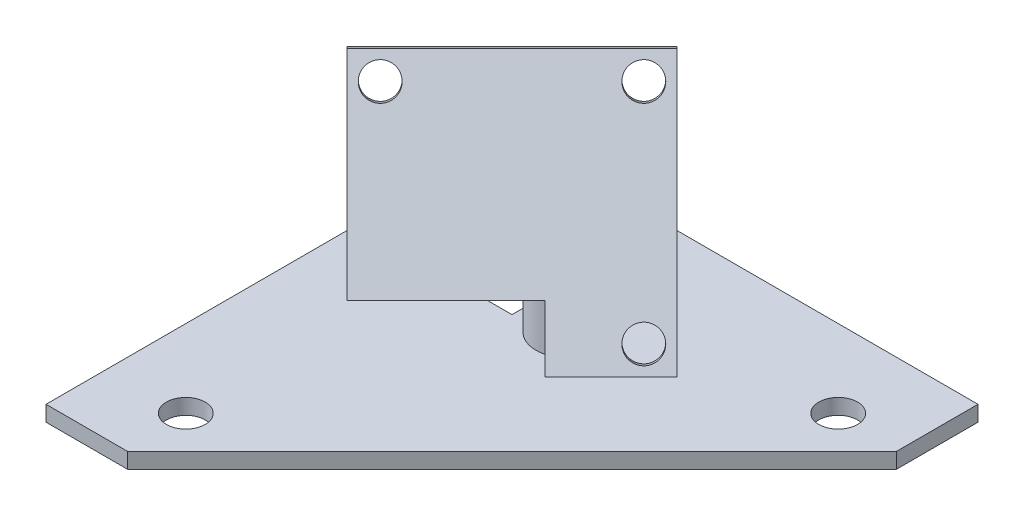
from build123d import *

# Parameters (mm, degrees)
SKETCH_1_R      = 2.5
EXTRUDE_1_DEPTH = 2
SKETCH_2_R      = 2
EXTRUDE_3_DEPTH = 2
EXTRUDE_4_REACH = 91.774
SKETCH_4_R      = 4


with BuildPart() as part:
    # 草图1 → 凸台-拉伸1 (new body)
    with BuildSketch(Plane(origin=(0, 0, 0), x_dir=(1, 0, 0), z_dir=(0, 1, 0))):
        Polygon((10.502525317, -60), (60, -10.502525317), (60, 0), (20, 0), (20, -20), (0, -20), (0, -60), align=None)
        with Locations(Location((10, -52, 0), (0, 0, 270))):
            Circle(SKETCH_1_R, mode=Mode.SUBTRACT)
        with Locations(Location((52, -10, 0), (0, 0, 270))):
            Circle(SKETCH_1_R, mode=Mode.SUBTRACT)
    extrude(amount=EXTRUDE_1_DEPTH)



with BuildPart() as body_2:
    # 草图2 → 凸台-拉伸3 (new body)
    with BuildSketch(Plane(origin=(23.112372436, 18.871173071, 23.112372436), x_dir=(-0.7071067811865475, 0, 0.7071067811865477), z_dir=(0.6123724356957955, 0.4999999999999981, 0.6123724356957954))):
        Polygon((-3, 16.786030205), (-15, 16.786030205), (-15, -13.213969795), (15, -13.213969795), (15, 9.786030205), (-3, 9.786030205), align=None)
        with Locations(Location((-12, -10.213969795, 0), (0, 0, 180))):
            Circle(SKETCH_2_R, mode=Mode.SUBTRACT)
        with Locations(Location((12, -10.213969795, 0), (0, 0, 180))):
            Circle(SKETCH_2_R, mode=Mode.SUBTRACT)
        with Locations(Location((-12, 13.786030205, 0), (0, 0, 180))):
            Circle(SKETCH_2_R, mode=Mode.SUBTRACT)
    extrude(amount=EXTRUDE_3_DEPTH)


with BuildPart() as part_1:
    add(part.part)

    add(body_2.part)  # 凸台-拉伸4 merges body 2
    # 凸台-拉伸4: up to this plane
    extrude_4_end = Plane(origin=(23.112372436, 18.871173071, 23.112372436), z_dir=(0.6123724356957954, 0.4999999999999981, 0.6123724356957952))
    # 草图4 → 凸台-拉伸4 (add, up to the surface)
    with BuildSketch(Plane(origin=(0, 2, 0), x_dir=(1, 0, 0), z_dir=(0, 1, 0)), mode=Mode.PRIVATE) as extrude_4_sk1:
        with Locations(Location((25.511596423, -18.440528611, 0), (0, 0, 315))):
            Circle(SKETCH_4_R)
    extrude_4_tool1 = split(extrude(extrude_4_sk1.sketch, amount=EXTRUDE_4_REACH, mode=Mode.PRIVATE), bisect_by=extrude_4_end, keep=Keep.BOTH, mode=Mode.PRIVATE)
    add(extrude_4_tool1.solids().sort_by_distance((25.511596, 2, 18.440529))[0])


solid = part_1.part
